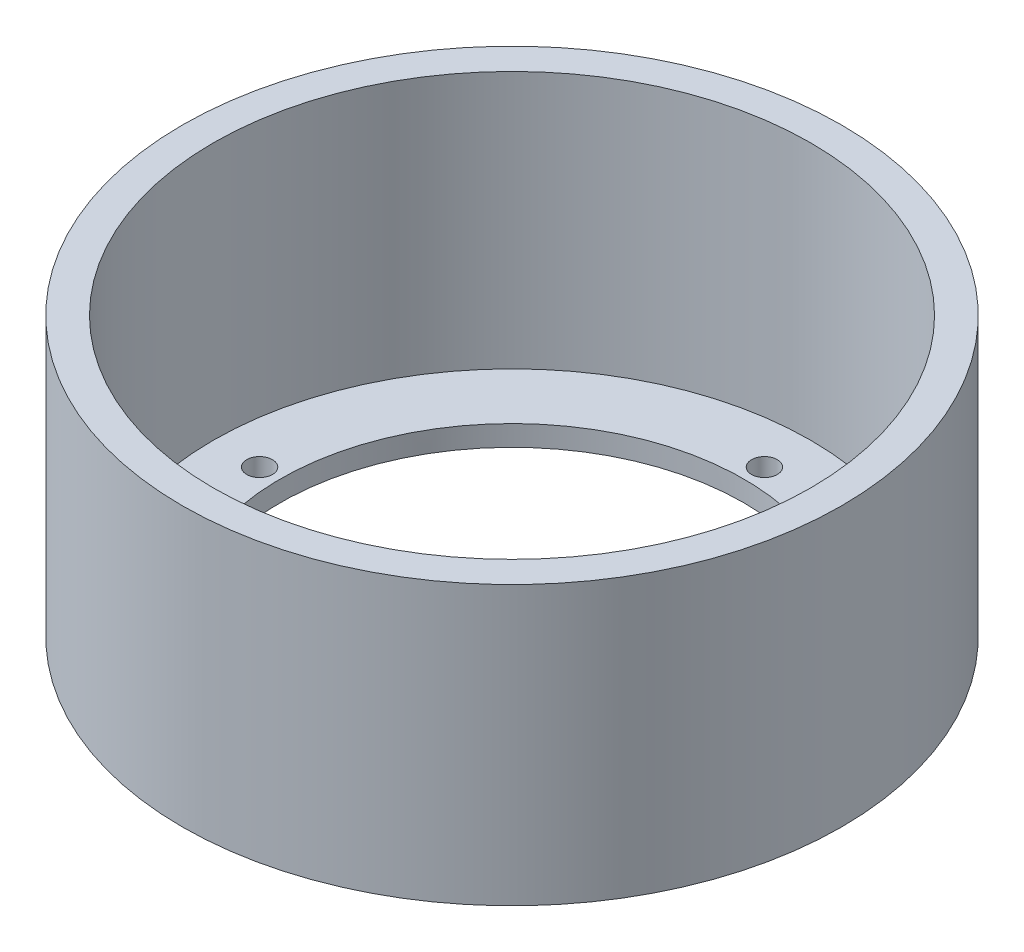
from build123d import *

# Parameters (mm, degrees)
SKETCH_1_R               = 32
EXTRUDE_1_DEPTH          = 27
CUT_EXTRUDE_3_DEPTH      = 51.318982502
CUT_EXTRUDE_3_DEPTH_BACK = 51.318982502
SKETCH_5_R               = 22.5
SKETCH_6_R               = 29
CUT_EXTRUDE_4_DEPTH      = 25
HOLE_WIZARD_M3_1_D       = 2.5


with BuildPart() as part:
    # 草图1 → 凸台-拉伸1 (new body)
    with BuildSketch(Plane(origin=(0, 0, 0), x_dir=(1, 0, 0), z_dir=(0, 1, 0))):
        with Locations(Location((0, 0, 0), (0, 0, 270))):
            Circle(SKETCH_1_R)
    extrude(amount=EXTRUDE_1_DEPTH)

    # 草图5 → 切除-拉伸3 (cut, two sides: drawn at the far end of the back side and taken through both)
    with BuildSketch(Plane(origin=(0, 5, 0), x_dir=(-1, 0, 0), z_dir=(0, -1, 0)).offset(-CUT_EXTRUDE_3_DEPTH_BACK)):
        with Locations(Location((0, 0, 0), (0, 0, 90))):
            Circle(SKETCH_5_R)
    extrude(amount=CUT_EXTRUDE_3_DEPTH + CUT_EXTRUDE_3_DEPTH_BACK, mode=Mode.SUBTRACT)

    # 草图6 → 切除-拉伸4 (cut)
    with BuildSketch(Plane(origin=(0, 27, 0), x_dir=(1, 0, 0), z_dir=(0, 1, 0))):
        with Locations(Location((0, 0, 0), (0, 0, 270))):
            Circle(SKETCH_6_R)
    extrude(amount=-CUT_EXTRUDE_4_DEPTH, mode=Mode.SUBTRACT)

    # M3 螺纹孔1 (through all)
    with Locations(Plane(origin=(0, 0, 0), x_dir=(-1, 0, 0), z_dir=(0, -1, 0))):
        with Locations((24.5, 0), (0, 24.5), (-24.5, 0), (0, -24.5)):
            Hole(HOLE_WIZARD_M3_1_D / 2)


solid = part.part
